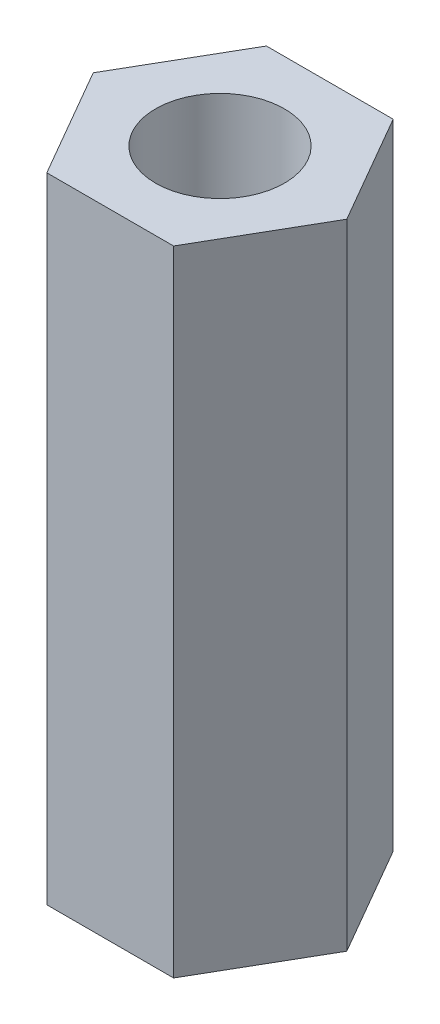
from build123d import *

# Parameters (mm, degrees)
BOSS_EXTRUDE1_DEPTH = 15
SKETCH2_R           = 1.525
CUT_EXTRUDE1_DEPTH  = 15


with BuildPart() as part:
    # Sketch1 → Boss-Extrude1 (new body)
    with BuildSketch(Plane(origin=(0, 0, 0), x_dir=(1, 0, 0), z_dir=(0, 1, 0))):
        Polygon((3, 0), (1.5, 2.598076211), (-1.5, 2.598076211), (-3, 0), (-1.5, -2.598076211), (1.5, -2.598076211), align=None)
    extrude(amount=BOSS_EXTRUDE1_DEPTH)

    # Sketch2 → Cut-Extrude1 (cut)
    with BuildSketch(Plane(origin=(0, 15, 0), x_dir=(1, 0, 0), z_dir=(0, 1, 0))):
        with Locations(Location((0, 0, 0), (0, 0, 270))):
            Circle(SKETCH2_R)
    extrude(amount=-CUT_EXTRUDE1_DEPTH, mode=Mode.SUBTRACT)


solid = part.part
